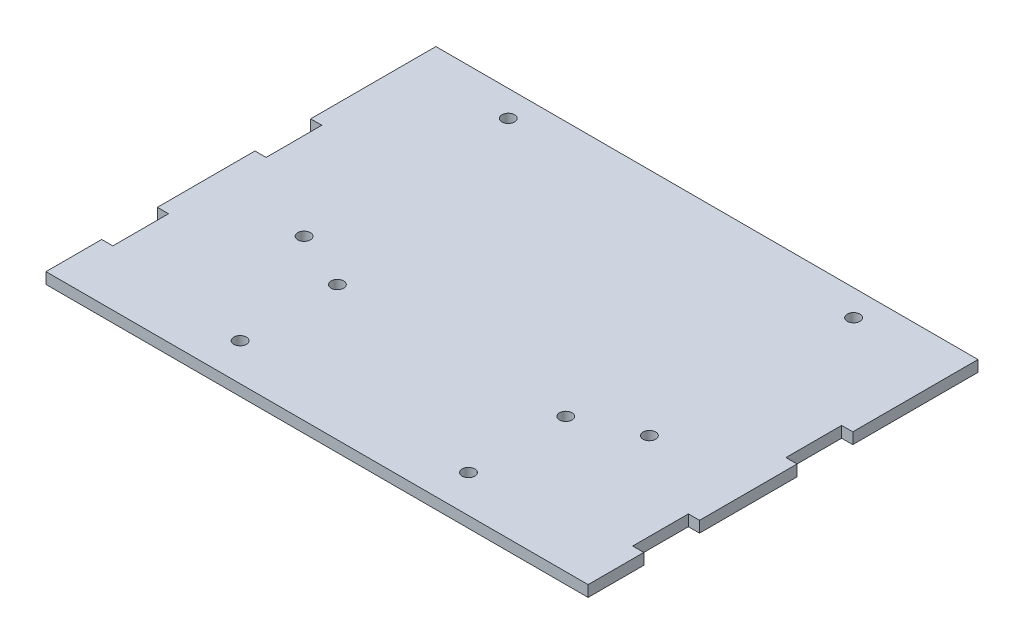
from build123d import *

# Parameters (mm, degrees)
SKETCH1_W           = 146
SKETCH1_H           = 105
BOSS_EXTRUDE1_DEPTH = 3
SKETCH2_R           = 1.7
SKETCH2_W           = 3
SKETCH2_H           = 15
CUT_EXTRUDE1_DEPTH  = 3


with BuildPart() as part:
    # Sketch1 → Boss-Extrude1 (new body)
    with BuildSketch(Plane(origin=(0, 0, 0), x_dir=(1, 0, 0), z_dir=(0, 1, 0))):
        Rectangle(SKETCH1_W, SKETCH1_H)
    extrude(amount=BOSS_EXTRUDE1_DEPTH)

    # Sketch2 → Cut-Extrude1 (cut)
    with BuildSketch(Plane(origin=(0, 3, 0), x_dir=(1, 0, 0), z_dir=(0, 1, 0))):
        with Locations(Location((-46.5, 45.5, 0), (0, 0, 270))):
            Circle(SKETCH2_R)
        with Locations(Location((46.5, 45.5, 0), (0, 0, 270))):
            Circle(SKETCH2_R)
        with Locations(Location((46.5, -9.5, 0), (0, 0, 270))):
            Circle(SKETCH2_R)
        with Locations(Location((-46.5, -9.5, 0), (0, 0, 270))):
            Circle(SKETCH2_R)
        with Locations(Location((-30.75, -16.278395091, 0), (0, 0, 270))):
            Circle(SKETCH2_R)
        with Locations(Location((30.75, -16.278395091, 0), (0, 0, 270))):
            Circle(SKETCH2_R)
        with Locations(Location((30.75, -42.478395091, 0), (0, 0, 270))):
            Circle(SKETCH2_R)
        with Locations(Location((-30.75, -42.478395091, 0), (0, 0, 270))):
            Circle(SKETCH2_R)
        with Locations((-71.5, -30)):
            Rectangle(SKETCH2_W, SKETCH2_H)
        with Locations((-71.5, 11.27)):
            Rectangle(SKETCH2_W, SKETCH2_H)
        with Locations((71.5, 11.27)):
            Rectangle(SKETCH2_W, SKETCH2_H)
        with Locations((71.5, -30)):
            Rectangle(SKETCH2_W, SKETCH2_H)
    extrude(amount=-CUT_EXTRUDE1_DEPTH, mode=Mode.SUBTRACT)


solid = part.part
